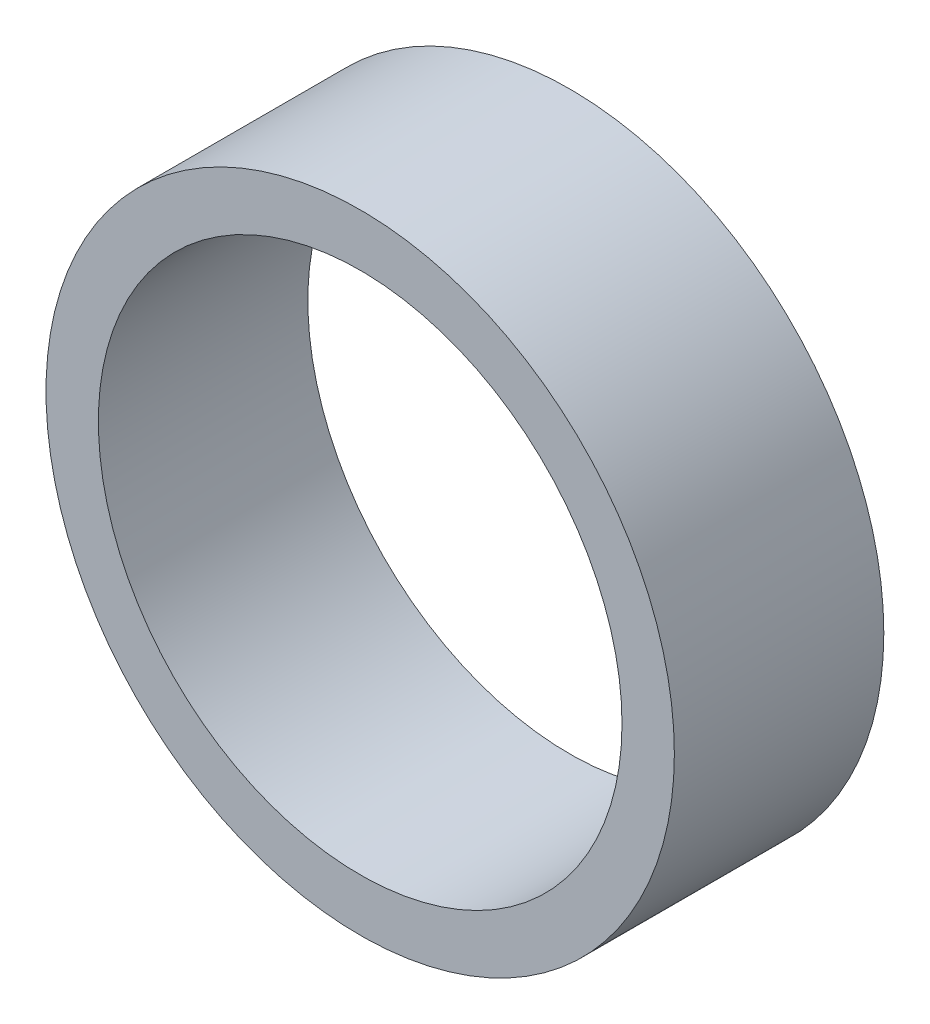
from build123d import *

# Parameters (mm, degrees)
SKETCH1_R           = 7.5
SKETCH1_R_2         = 6.25
BOSS_EXTRUDE1_DEPTH = 5


with BuildPart() as part:
    # Sketch1 → Boss-Extrude1 (new body)
    with BuildSketch(Plane(origin=(0, 0, 0), x_dir=(0, 1, 0), z_dir=(0, 0, 1))):
        with Locations(Location((0, 0, 0), (0, 0, 270))):
            Circle(SKETCH1_R)
        with Locations(Location((0, 0, 0), (0, 0, 270))):
            Circle(SKETCH1_R_2, mode=Mode.SUBTRACT)
    extrude(amount=BOSS_EXTRUDE1_DEPTH)


solid = part.part
